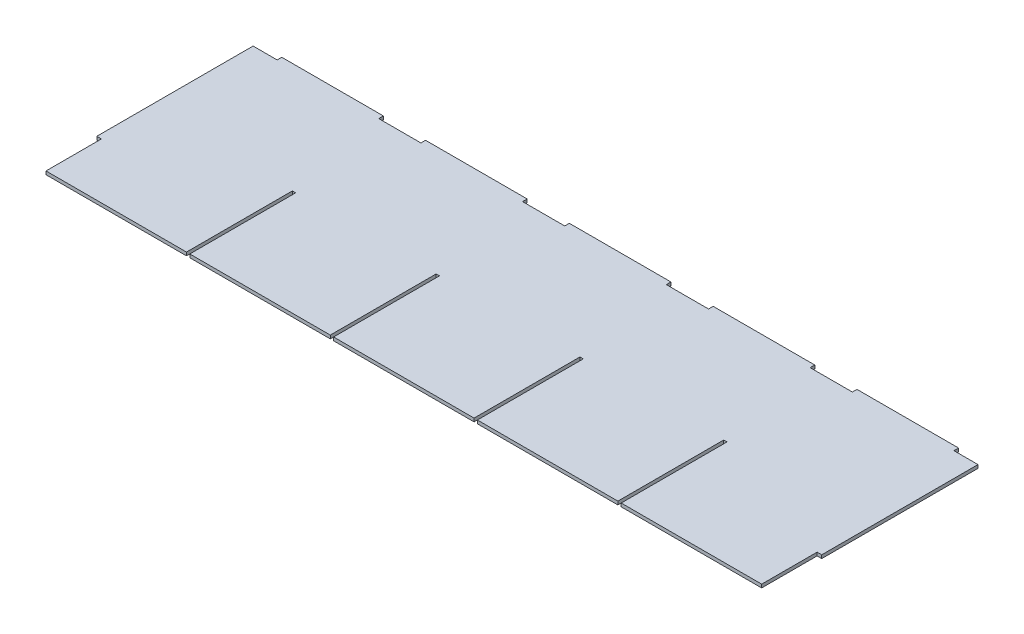
from build123d import *

# Parameters (mm, degrees)
SKETCH1_W           = 498.348
SKETCH1_H           = 145.542
BOSS_EXTRUDE1_DEPTH = 1.143
SKETCH2_W           = 69.85
SKETCH2_H           = 2.286
BOSS_EXTRUDE2_DEPTH = 3.175
LPATTERN1_COUNT     = 5
LPATTERN1_PITCH     = 98.8568
SKETCH3_W           = 3.175
SKETCH3_H           = 38.1
CUT_EXTRUDE1_DEPTH  = 261.500869457
SKETCH5_W           = 2.286
SKETCH5_H           = 72.771
CUT_EXTRUDE2_DEPTH  = 261.500869457
LPATTERN2_COUNT     = 4
LPATTERN2_PITCH     = 98.8568


with BuildPart() as part:
    # Sketch1 → Boss-Extrude1 (new, symmetric)
    with BuildSketch(Plane(origin=(0, 0, 0), x_dir=(1, 0, 0), z_dir=(0, 1, 0))):
        Rectangle(SKETCH1_W, SKETCH1_H)
    extrude(amount=BOSS_EXTRUDE1_DEPTH, both=True)

    # Sketch2 → Boss-Extrude2 (add)
    with BuildSketch(Plane(origin=(0, 0, -72.771), x_dir=(-1, 0, 0), z_dir=(0, 0, -1))):
        with Locations((-197.7136, 0)):
            Rectangle(SKETCH2_W, SKETCH2_H)
    boss_extrude2 = extrude(amount=BOSS_EXTRUDE2_DEPTH)

    # LPattern1: Boss-Extrude2 ×5
    with Locations(*[(-i * LPATTERN1_PITCH, 0, 0) for i in range(1, LPATTERN1_COUNT)]):
        add(boss_extrude2)

    # Sketch3 → Cut-Extrude1 (cut, through all)
    with BuildSketch(Plane.XZ.offset(1.143)):
        with Locations((-247.5865, 53.721)):
            Rectangle(SKETCH3_W, SKETCH3_H)
    cut_extrude1 = extrude(amount=-CUT_EXTRUDE1_DEPTH, mode=Mode.SUBTRACT)

    # Mirror2: Cut-Extrude1 across plane
    add(cut_extrude1.mirror(Plane(origin=(0, 0, 0), x_dir=(0, 0, 1), z_dir=(1, 0, 0))), mode=Mode.SUBTRACT)

    # Sketch5 → Cut-Extrude2 (cut, through all)
    with BuildSketch(Plane.XZ.offset(1.143)):
        with Locations((-148.2852, 36.3855)):
            Rectangle(SKETCH5_W, SKETCH5_H)
    cut_extrude2 = extrude(amount=-CUT_EXTRUDE2_DEPTH, mode=Mode.SUBTRACT)

    # LPattern2: Cut-Extrude2 ×4
    with Locations(*[(i * LPATTERN2_PITCH, 0, 0) for i in range(1, LPATTERN2_COUNT)]):
        add(cut_extrude2, mode=Mode.SUBTRACT)


solid = part.part
